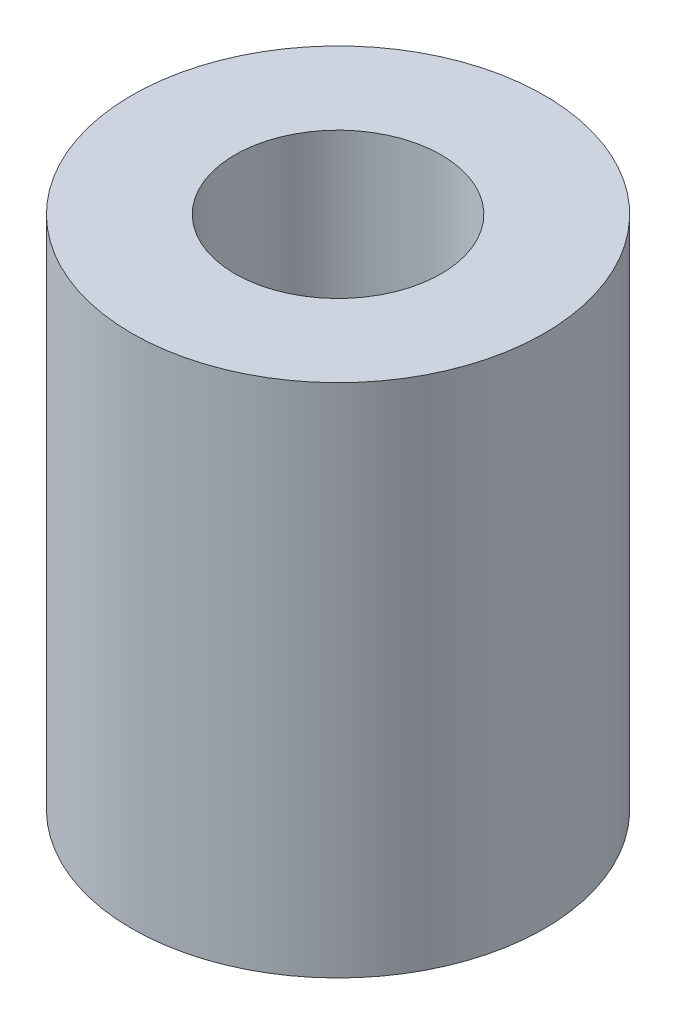
from build123d import *

# Parameters (mm, degrees)
SKETCH1_R           = 2
SKETCH1_R_2         = 1
BOSS_EXTRUDE1_DEPTH = 2.5


with BuildPart() as part:
    # Sketch1 → Boss-Extrude1 (new, symmetric)
    with BuildSketch(Plane(origin=(0, 0, 0), x_dir=(1, 0, 0), z_dir=(0, 1, 0))):
        with Locations(Location((0, 0, 0), (0, 0, 270))):
            Circle(SKETCH1_R)
        with Locations(Location((0, 0, 0), (0, 0, 270))):
            Circle(SKETCH1_R_2, mode=Mode.SUBTRACT)
    extrude(amount=BOSS_EXTRUDE1_DEPTH, both=True)


solid = part.part
